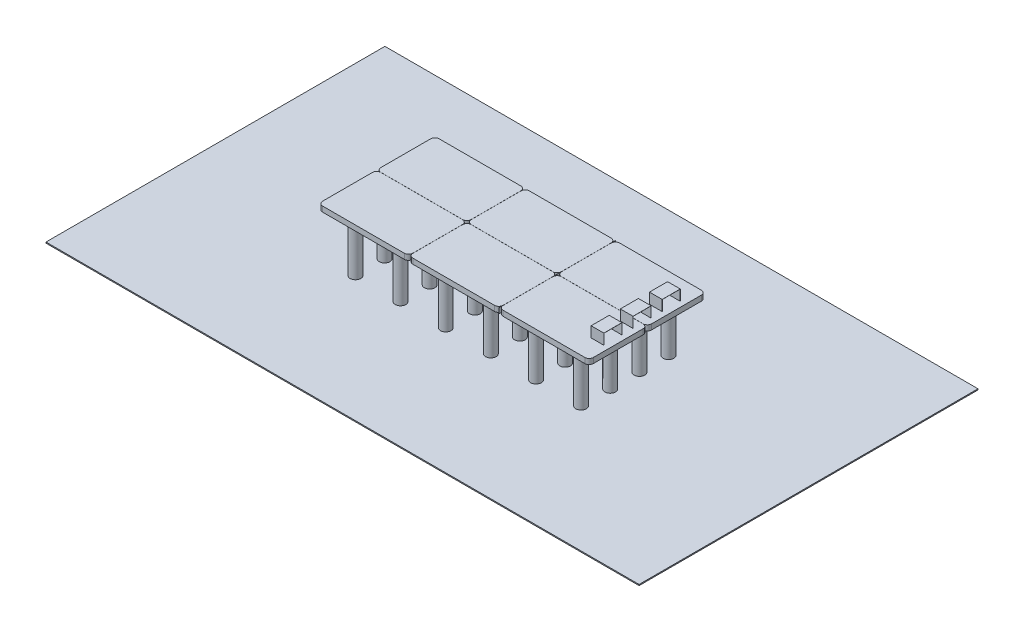
from build123d import *

# Parameters (mm, degrees)
SKETCH_1_W          = 2556
SKETCH_1_H          = 1100
EXTRUDE_1_DEPTH     = 50
CUT_EXTRUDE_1_DEPTH = 1393.222683338
SKETCH_3_R          = 50
EXTRUDE_2_DEPTH     = 500
CUT_EXTRUDE_3_DEPTH = 1497.089569511
SKETCH_5_W          = 5600
SKETCH_5_H          = 3200
EXTRUDE_3_DEPTH     = 10
SKETCH_6_W          = 120
SKETCH_6_H          = 170.84
EXTRUDE_4_DEPTH     = 99.6
SKETCH_7_W          = 168.84
SKETCH_7_H          = 98.6
CUT_EXTRUDE_4_DEPTH = 139.6


with BuildPart() as part:
    # 스케치1 → 보스-돌출1 (new body)
    with BuildSketch(Plane(origin=(0, 0, 0), x_dir=(1, 0, 0), z_dir=(0, 1, 0))):
        Rectangle(SKETCH_1_W, SKETCH_1_H)
    extrude(amount=EXTRUDE_1_DEPTH)

    # 스케치2 → 컷-돌출1 (cut, through all)
    with BuildSketch(Plane.XZ):
        Polygon((-426.666666667, 550), (-426.666666667, 0.5), (-1278, 0.5), (-1278, -0.5), (-426.666666667, -0.5), (-426.666666667, -550), (-425.666666667, -550), (-425.666666667, -0.5), (425.666666667, -0.5), (425.666666667, -550), (426.666666667, -550), (426.666666667, -0.5), (1278, -0.5), (1278, 0.5), (426.666666667, 0.5), (426.666666667, 550), (425.666666667, 550), (425.666666667, 0.5), (-425.666666667, 0.5), (-425.666666667, 550), align=None)
    extrude(amount=-CUT_EXTRUDE_1_DEPTH, mode=Mode.SUBTRACT)


with BuildPart() as cut_extrude_1_piece_1:
    # of the separate pieces the step leaves, piece 1, a body of its own (cut_extrude_1_pieces)
    add(part.part.solids().sort_by_distance((-1278, 0, -550))[0])



with BuildPart() as cut_extrude_1_piece_2:
    # of the separate pieces the step leaves, piece 2, a body of its own (cut_extrude_1_pieces)
    add(part.part.solids().sort_by_distance((-425.666666667, 0, -550))[0])


with BuildPart() as cut_extrude_1_piece_3:
    # of the separate pieces the step leaves, piece 3, a body of its own (cut_extrude_1_pieces)
    add(part.part.solids().sort_by_distance((-1278, 0, 550))[0])


with BuildPart() as cut_extrude_1_piece_4:
    # of the separate pieces the step leaves, piece 4, a body of its own (cut_extrude_1_pieces)
    add(part.part.solids().sort_by_distance((425.666666667, 0, 550))[0])


with BuildPart() as cut_extrude_1_piece_5:
    # of the separate pieces the step leaves, piece 5, a body of its own (cut_extrude_1_pieces)
    add(part.part.solids().sort_by_distance((426.666666667, 0, -550))[0])


with BuildPart() as cut_extrude_1_piece_6:
    # of the separate pieces the step leaves, piece 6, a body of its own (cut_extrude_1_pieces)
    add(part.part.solids().sort_by_distance((1278, 0, 0.5))[0])


with BuildPart() as cut_extrude_1_piece_1_1:
    add(cut_extrude_1_piece_1.part)

    add(cut_extrude_1_piece_2.part)  # 보스-돌출2 merges 컷-돌출1 piece 2

    add(cut_extrude_1_piece_3.part)  # 보스-돌출2 merges 컷-돌출1 piece 3

    add(cut_extrude_1_piece_4.part)  # 보스-돌출2 merges 컷-돌출1 piece 4

    add(cut_extrude_1_piece_5.part)  # 보스-돌출2 merges 컷-돌출1 piece 5

    add(cut_extrude_1_piece_6.part)  # 보스-돌출2 merges 컷-돌출1 piece 6
    # 스케치3 → 보스-돌출2 (add)
    with BuildSketch(Plane.XZ):
        with Locations(Location((-1065.166666667, -137.875, 0), (0, 0, 90))):
            Circle(SKETCH_3_R)
        with Locations(Location((-639.5, -137.875, 0), (0, 0, 90))):
            Circle(SKETCH_3_R)
        with Locations(Location((-639.5, -412.625, 0), (0, 0, 90))):
            Circle(SKETCH_3_R)
        with Locations(Location((-1065.166666667, -412.625, 0), (0, 0, 90))):
            Circle(SKETCH_3_R)
        with Locations(Location((-212.833333333, -137.875, 0), (0, 0, 90))):
            Circle(SKETCH_3_R)
        with Locations(Location((212.833333333, -137.875, 0), (0, 0, 90))):
            Circle(SKETCH_3_R)
        with Locations(Location((-212.833333333, -412.625, 0), (0, 0, 90))):
            Circle(SKETCH_3_R)
        with Locations(Location((212.833333333, -412.625, 0), (0, 0, 90))):
            Circle(SKETCH_3_R)
        with Locations(Location((639.5, -137.875, 0), (0, 0, 90))):
            Circle(SKETCH_3_R)
        with Locations(Location((1065.166666667, -137.875, 0), (0, 0, 90))):
            Circle(SKETCH_3_R)
        with Locations(Location((639.5, -412.625, 0), (0, 0, 90))):
            Circle(SKETCH_3_R)
        with Locations(Location((1065.166666667, -412.625, 0), (0, 0, 90))):
            Circle(SKETCH_3_R)
        with Locations(Location((-212.833333333, 412.625, 0), (0, 0, 90))):
            Circle(SKETCH_3_R)
        with Locations(Location((212.833333333, 412.625, 0), (0, 0, 90))):
            Circle(SKETCH_3_R)
        with Locations(Location((-212.833333333, 137.875, 0), (0, 0, 90))):
            Circle(SKETCH_3_R)
        with Locations(Location((212.833333333, 137.875, 0), (0, 0, 90))):
            Circle(SKETCH_3_R)
        with Locations(Location((639.5, 412.625, 0), (0, 0, 90))):
            Circle(SKETCH_3_R)
        with Locations(Location((1065.166666667, 412.625, 0), (0, 0, 90))):
            Circle(SKETCH_3_R)
        with Locations(Location((639.5, 137.875, 0), (0, 0, 90))):
            Circle(SKETCH_3_R)
        with Locations(Location((1065.166666667, 137.875, 0), (0, 0, 90))):
            Circle(SKETCH_3_R)
        with Locations(Location((-1065.166666667, 412.625, 0), (0, 0, 90))):
            Circle(SKETCH_3_R)
        with Locations(Location((-639.5, 412.625, 0), (0, 0, 90))):
            Circle(SKETCH_3_R)
        with Locations(Location((-1065.166666667, 137.875, 0), (0, 0, 90))):
            Circle(SKETCH_3_R)
        with Locations(Location((-639.5, 137.875, 0), (0, 0, 90))):
            Circle(SKETCH_3_R)
    extrude(amount=EXTRUDE_2_DEPTH)

    # 스케치4 → 컷-돌출3 (cut, through all)
    with BuildSketch(Plane(origin=(0, 50, 0), x_dir=(1, 0, 0), z_dir=(0, 1, 0))):
        with BuildLine():
            ThreePointArc((-385.67, 550), (-413.954271247, 538.284271247), (-425.67, 510))
            Line((-425.67, 510), (-425.67, 550))
            Line((-425.67, 550), (-385.67, 550))
        make_face()
        with BuildLine():
            ThreePointArc((466.666666667, 550), (438.382395419, 538.284271247), (426.666666667, 510))
            Line((426.666666667, 510), (426.666666667, 550))
            Line((426.666666667, 550), (466.666666667, 550))
        make_face()
        with BuildLine():
            Line((425.663333333, 510.730266314), (425.663333333, 550))
            Line((425.663333333, 550), (385.67, 550))
            ThreePointArc((385.67, 550), (413.694893822, 538.541291601), (425.663333333, 510.730266314))
        make_face()
        with BuildLine():
            Line((-426.666666667, 550), (-466.666666667, 550))
            ThreePointArc((-466.666666667, 550), (-438.382395419, 538.284271247), (-426.666666667, 510))
            Line((-426.666666667, 510), (-426.666666667, 550))
        make_face()
        with BuildLine():
            ThreePointArc((-1238, 550), (-1266.284271247, 538.284271247), (-1278, 510))
            Line((-1278, 510), (-1278, 550))
            Line((-1278, 550), (-1238, 550))
        make_face()
        with BuildLine():
            Line((1278, 550), (1238, 550))
            ThreePointArc((1238, 550), (1266.284271247, 538.284271247), (1278, 510))
            Line((1278, 510), (1278, 550))
        make_face()
        with BuildLine():
            Line((-1278, -0.5), (-1278, -40.5))
            ThreePointArc((-1278, -40.5), (-1266.284271247, -12.215728753), (-1238, -0.5))
            Line((-1238, -0.5), (-1278, -0.5))
        make_face()
        with BuildLine():
            Line((-1278, 0.5), (-1238, 0.5))
            ThreePointArc((-1238, 0.5), (-1266.284271247, 12.215728753), (-1278, 40.5))
            Line((-1278, 40.5), (-1278, 0.5))
        make_face()
        with BuildLine():
            Line((-426.666666667, -0.5), (-466.666666667, -0.5))
            ThreePointArc((-466.666666667, -0.5), (-438.382395419, -12.215728753), (-426.666666667, -40.5))
            Line((-426.666666667, -40.5), (-426.666666667, -0.5))
        make_face()
        with BuildLine():
            ThreePointArc((-466.666666667, 0.5), (-438.382395419, 12.215728753), (-426.666666667, 40.5))
            Line((-426.666666667, 40.5), (-426.666666667, 0.5))
            Line((-426.666666667, 0.5), (-466.666666667, 0.5))
        make_face()
        with BuildLine():
            Line((-425.67, 0.5), (-385.67, 0.5))
            ThreePointArc((-385.67, 0.5), (-413.954271247, 12.215728753), (-425.67, 40.5))
            Line((-425.67, 40.5), (-425.67, 0.5))
        make_face()
        with BuildLine():
            ThreePointArc((-385.67, -0.5), (-413.954271247, -12.215728753), (-425.67, -40.5))
            Line((-425.67, -40.5), (-425.67, -0.5))
            Line((-425.67, -0.5), (-385.67, -0.5))
        make_face()
        with BuildLine():
            Line((425.663333333, 0.5), (425.663333333, 39.769733686))
            ThreePointArc((425.663333333, 39.769733686), (413.694893822, 11.958708399), (385.67, 0.5))
            Line((385.67, 0.5), (425.663333333, 0.5))
        make_face()
        with BuildLine():
            Line((426.666666667, 0.5), (466.666666667, 0.5))
            ThreePointArc((466.666666667, 0.5), (438.382395419, 12.215728753), (426.666666667, 40.5))
            Line((426.666666667, 40.5), (426.666666667, 0.5))
        make_face()
        with BuildLine():
            ThreePointArc((466.666666667, -0.5), (438.382395419, -12.215728753), (426.666666667, -40.5))
            Line((426.666666667, -40.5), (426.666666667, -0.5))
            Line((426.666666667, -0.5), (466.666666667, -0.5))
        make_face()
        with BuildLine():
            Line((425.663333333, -39.769733686), (425.663333333, -0.5))
            Line((425.663333333, -0.5), (385.67, -0.5))
            ThreePointArc((385.67, -0.5), (413.694893822, -11.958708399), (425.663333333, -39.769733686))
        make_face()
        with BuildLine():
            ThreePointArc((1238, 0.5), (1266.284271247, 12.215728753), (1278, 40.5))
            Line((1278, 40.5), (1278, 0.5))
            Line((1278, 0.5), (1238, 0.5))
        make_face()
        with BuildLine():
            Line((1278, -0.5), (1238, -0.5))
            ThreePointArc((1238, -0.5), (1266.284271247, -12.215728753), (1278, -40.5))
            Line((1278, -40.5), (1278, -0.5))
        make_face()
        with BuildLine():
            ThreePointArc((1238, -550), (1266.284271247, -538.284271247), (1278, -510))
            Line((1278, -510), (1278, -550))
            Line((1278, -550), (1238, -550))
        make_face()
        with BuildLine():
            Line((426.666666667, -550), (466.666666667, -550))
            ThreePointArc((466.666666667, -550), (438.382395419, -538.284271247), (426.666666667, -510))
            Line((426.666666667, -510), (426.666666667, -550))
        make_face()
        with BuildLine():
            Line((425.663333333, -550), (425.663333333, -510.730266314))
            ThreePointArc((425.663333333, -510.730266314), (413.694893822, -538.541291601), (385.67, -550))
            Line((385.67, -550), (425.663333333, -550))
        make_face()
        with BuildLine():
            ThreePointArc((-426.666666667, -510), (-438.382395419, -538.284271247), (-466.666666667, -550))
            Line((-466.666666667, -550), (-426.666666667, -550))
            Line((-426.666666667, -550), (-426.666666667, -510))
        make_face()
        with BuildLine():
            Line((-425.67, -550), (-385.67, -550))
            ThreePointArc((-385.67, -550), (-413.954271247, -538.284271247), (-425.67, -510))
            Line((-425.67, -510), (-425.67, -550))
        make_face()
        with BuildLine():
            ThreePointArc((-1238, -550), (-1266.284271247, -538.284271247), (-1278, -510))
            Line((-1278, -510), (-1278, -550))
            Line((-1278, -550), (-1238, -550))
        make_face()
    extrude(amount=-CUT_EXTRUDE_3_DEPTH, mode=Mode.SUBTRACT)

    # 스케치5 → 보스-돌출3 (add)
    with BuildSketch(Plane.XZ.offset(500)):
        Rectangle(SKETCH_5_W, SKETCH_5_H)
    extrude(amount=EXTRUDE_3_DEPTH)

    # 스케치6 → 보스-돌출4 (add)
    with BuildSketch(Plane(origin=(0, 50, 0), x_dir=(1, 0, 0), z_dir=(0, 1, 0))):
        with Locations((1168, 275.25)):
            Rectangle(SKETCH_6_W, SKETCH_6_H)
        with Locations((1168, -275.25)):
            Rectangle(SKETCH_6_W, SKETCH_6_H)
        with Locations((1168, 0)):
            Rectangle(SKETCH_6_W, SKETCH_6_H)
    extrude(amount=EXTRUDE_4_DEPTH)

    # 스케치7 → 컷-돌출4 (cut)
    with BuildSketch(Plane.ZY.offset(-1108)):
        with Locations((-275.25, 99.3)):
            Rectangle(SKETCH_7_W, SKETCH_7_H)
        with Locations((0, 99.3)):
            Rectangle(SKETCH_7_W, SKETCH_7_H)
        with Locations((275.25, 99.3)):
            Rectangle(SKETCH_7_W, SKETCH_7_H)
    extrude(amount=-CUT_EXTRUDE_4_DEPTH, mode=Mode.SUBTRACT)


solid = cut_extrude_1_piece_1_1.part
